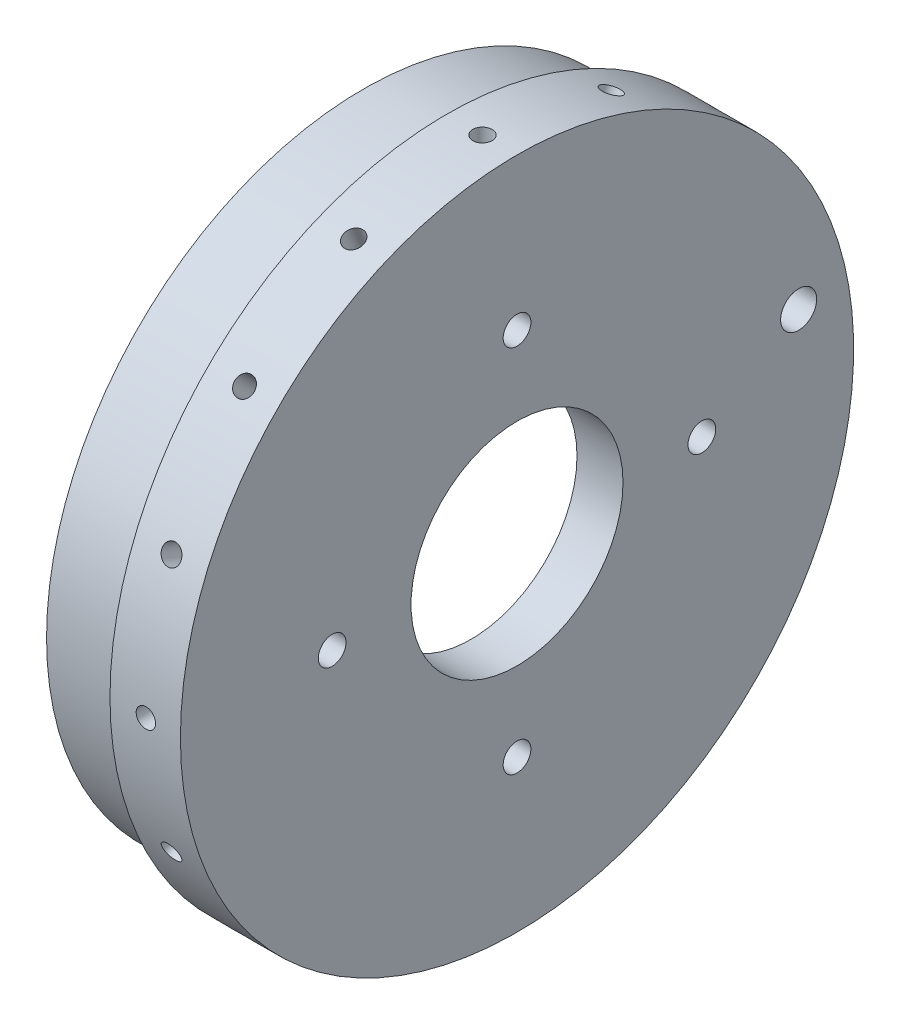
from build123d import *

# Parameters (mm, degrees)
CIRPATTERN3_COUNT  = 16
CUT_EXTRUDE1_START = -19.23
SKETCH6_R          = 57.15
CUT_EXTRUDE1_DEPTH = 19.23
SKETCH9_R          = 19.1135
CUT_EXTRUDE4_DEPTH = 19.23
SKETCH10_R         = 47.50635
CUT_EXTRUDE5_DEPTH = 15
SKETCH11_R         = 39
CUT_EXTRUDE6_DEPTH = 4.4
CIRPATTERN4_COUNT  = 8
SKETCH8_R          = 2.5
CUT_EXTRUDE7_DEPTH = 10
CIRPATTERN5_COUNT  = 4
CUT_EXTRUDE8_REACH = 92.208
SKETCH26_R         = 3.25


with BuildPart() as part:
    # Sketch4 → Revolve1 (revolve)
    with BuildSketch(Plane.XY, mode=Mode.PRIVATE) as revolve1_sk:
        Polygon((0, 0), (0, 57.15), (34.225, 57.15), (34.225, 60.706), (46.925, 60.706), (46.925, 0), align=None)
    revolve(revolve1_sk.sketch.rotate(Axis((0, 0, 0), (1, 0, 0)), 90), axis=Axis((0, 0, 0), (1, 0, 0)))

    # Sketch5 → #6-32 Tapped Hole1 (revolve, cut)
    with BuildSketch(Plane(origin=(40.702, 0, 60.706), x_dir=(0, -1, 0), z_dir=(1, 0, 0))):
        Polygon((0, 0), (0, 13.51269403), (1.35255, 12.7), (1.35255, 10.16), (1.7526, 10.16), (1.7526, 0), align=None)
    f_6_32_tapped_hole1 = revolve(axis=Axis((40.702, 0, 67.056), (0, 0, -1)), mode=Mode.SUBTRACT)

    # CirPattern3: #6-32 Tapped Hole1 ×16 about axis
    cirpattern3_axis = Axis((0, 0, 0), (1, 0, 0))
    for i in range(1, CIRPATTERN3_COUNT):
        add(f_6_32_tapped_hole1.rotate(cirpattern3_axis, i * 360 / CIRPATTERN3_COUNT), mode=Mode.SUBTRACT)

    # Sketch6 → Cut-Extrude1 (cut)
    with BuildSketch(Plane.ZY.offset(CUT_EXTRUDE1_START)):
        Circle(SKETCH6_R)
    extrude(amount=CUT_EXTRUDE1_DEPTH, mode=Mode.SUBTRACT)

    # Sketch9 → Cut-Extrude4 (cut)
    with BuildSketch(Plane(origin=(46.925, 0, 0), x_dir=(0, 0, -1), z_dir=(1, 0, 0))):
        Circle(SKETCH9_R)
    extrude(amount=-CUT_EXTRUDE4_DEPTH, mode=Mode.SUBTRACT)

    # Sketch10 → Cut-Extrude5 (cut)
    with BuildSketch(Plane.ZY.offset(-19.23)):
        Circle(SKETCH10_R)
    extrude(amount=-CUT_EXTRUDE5_DEPTH, mode=Mode.SUBTRACT)

    # Sketch11 → Cut-Extrude6 (cut)
    with BuildSketch(Plane.ZY.offset(-34.23)):
        Circle(SKETCH11_R)
    extrude(amount=-CUT_EXTRUDE6_DEPTH, mode=Mode.SUBTRACT)

    # Sketch13 → M4x0.7 Tapped Hole1 (revolve, cut)
    with BuildSketch(Plane(origin=(34.23, 40.516284295, 8.982243978), x_dir=(0, 0, 1), z_dir=(0, 1, 0))):
        Polygon((0, 0), (0, 12.491420021), (1.65, 11.5), (1.65, 8), (2, 8), (2, 0), align=None)
    m4x0_7_tapped_hole1 = revolve(axis=Axis((27.88, 40.516284295, 8.982243978), (1, 0, 0)), mode=Mode.SUBTRACT)

    # CirPattern4: M4x0.7 Tapped Hole1 ×8 about axis
    cirpattern4_axis = Axis((0, 0, 0), (1, 0, 0))
    for i in range(1, CIRPATTERN4_COUNT):
        add(m4x0_7_tapped_hole1.rotate(cirpattern4_axis, i * 360 / CIRPATTERN4_COUNT), mode=Mode.SUBTRACT)

    # Sketch8 → Cut-Extrude7 (cut)
    with BuildSketch(Plane(origin=(46.925, 0, 0), x_dir=(0, 0, -1), z_dir=(1, 0, 0))):
        with Locations((33.335, 0)):
            Circle(SKETCH8_R)
    cut_extrude7 = extrude(amount=-CUT_EXTRUDE7_DEPTH, mode=Mode.SUBTRACT)

    # CirPattern5: Cut-Extrude7 ×4 about axis
    cirpattern5_axis = Axis((0, 0, 0), (1, 0, 0))
    for i in range(1, CIRPATTERN5_COUNT):
        add(cut_extrude7.rotate(cirpattern5_axis, i * 360 / CIRPATTERN5_COUNT), mode=Mode.SUBTRACT)

    # Sketch26 → Cut-Extrude8 (cut, up to next)
    with BuildSketch(Plane.ZY.offset(-19.23), mode=Mode.PRIVATE) as cut_extrude8_sk1:
        with Locations((-50.788379765, 11.165645273)):
            Circle(SKETCH26_R)
    cut_extrude8_tool1 = extrude(cut_extrude8_sk1.sketch, amount=-CUT_EXTRUDE8_REACH, mode=Mode.PRIVATE) & part.part
    add(cut_extrude8_tool1.solids().sort_by_distance((19.23, 11.165645, -50.78838))[0], mode=Mode.SUBTRACT)


solid = part.part
